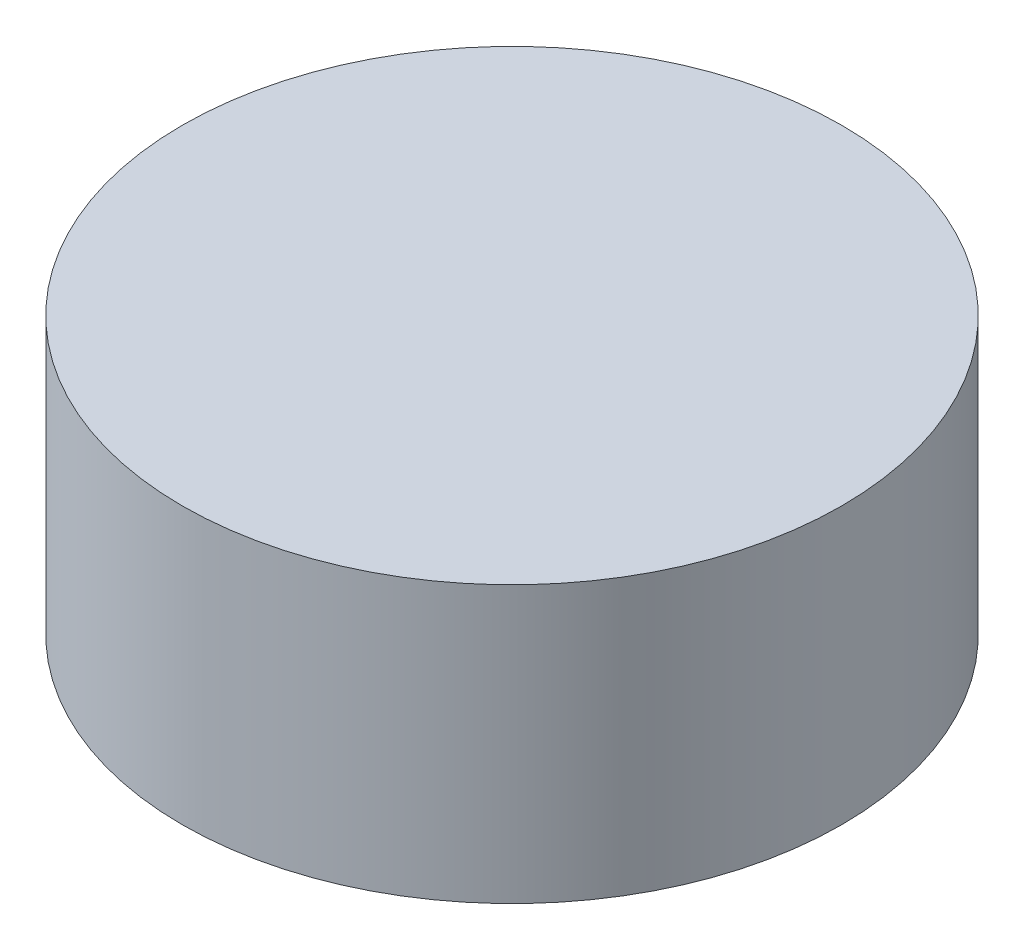
from build123d import *

# Parameters (mm, degrees)
SKETCH1_R           = 20.32
BOSS_EXTRUDE1_DEPTH = 17.018


with BuildPart() as part:
    # Sketch1 → Boss-Extrude1 (new body)
    with BuildSketch(Plane(origin=(0, 0, 0), x_dir=(1, 0, 0), z_dir=(0, 1, 0))):
        with Locations(Location((0, 0, 0), (0, 0, 270))):
            Circle(SKETCH1_R)
    extrude(amount=BOSS_EXTRUDE1_DEPTH)


solid = part.part
